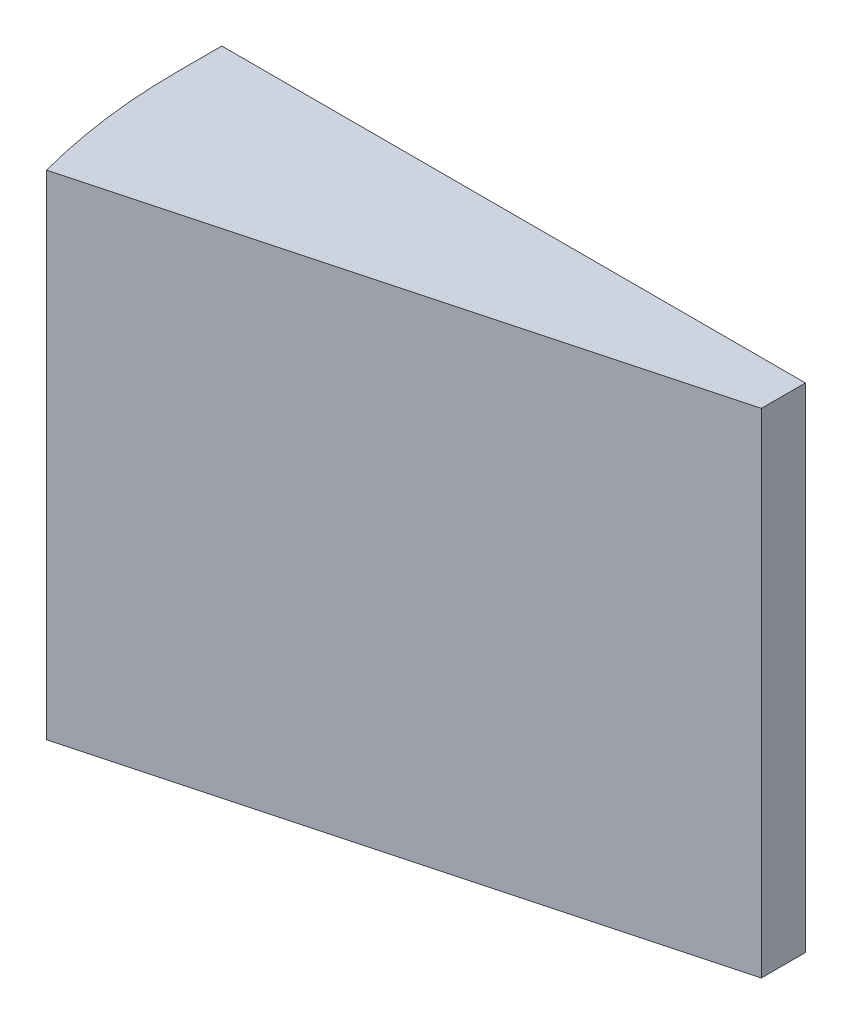
from build123d import *

# Parameters (mm, degrees)
SKETCH1_W           = 26.5
SKETCH1_H           = 22.4
BOSS_EXTRUDE1_DEPTH = 2
BOSS_EXTRUDE2_DEPTH = 22.4


with BuildPart() as part:
    # Sketch1 → Boss-Extrude1 (new body)
    with BuildSketch(Plane.XY):
        Rectangle(SKETCH1_W, SKETCH1_H)
    extrude(amount=BOSS_EXTRUDE1_DEPTH)

    # Sketch2 → Boss-Extrude2 (add)
    with BuildSketch(Plane(origin=(0, 11.2, 0), x_dir=(1, 0, 0), z_dir=(0, 1, 0))):
        with BuildLine():
            Line((13.25, -2), (-12.347034397, -8.858704695))
            ThreePointArc((-12.347034397, -8.858704695), (-13.023288826, -5.458944094), (-13.25, -2))
            Line((-13.25, -2), (13.25, -2))
        make_face()
    extrude(amount=-BOSS_EXTRUDE2_DEPTH)


solid = part.part
